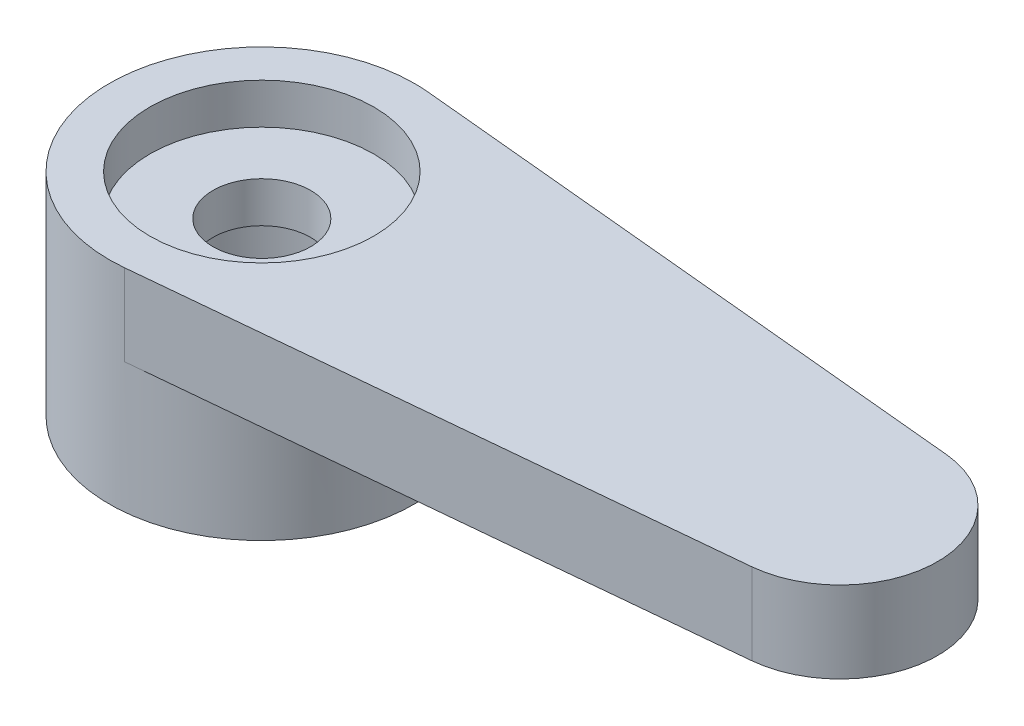
from build123d import *
from build123d.topology import SkipClean

# Parameters (mm, degrees)
SKETCH1_R           = 1.2
BOSS_EXTRUDE1_DEPTH = 2
BOSS_EXTRUDE2_START = 3.2
SKETCH2_R           = 1.2
BOSS_EXTRUDE2_DEPTH = 3.2
SKETCH3_R           = 2.4
CUT_EXTRUDE3_DEPTH  = 3.2
SKETCH4_R           = 2.75
CUT_EXTRUDE4_DEPTH  = 1


with BuildPart() as part:
    # Sketch1 → Boss-Extrude1 (new body)
    with BuildSketch(Plane(origin=(0, 0, 0), x_dir=(1, 0, 0), z_dir=(0, 1, 0))):
        with BuildLine():
            Line((0.356514085, 3.73301456), (14.428169014, 2.389129319))
            ThreePointArc((14.428169014, 2.389129319), (16.6, 0), (14.428169014, -2.389129319))
            Line((14.428169014, -2.389129319), (0.356514085, -3.73301456))
            ThreePointArc((0.356514085, -3.73301456), (-3.75, 0), (0.356514085, 3.73301456))
        make_face()
        with Locations(Location((0, 0, 0), (0, 0, 270))):
            Circle(SKETCH1_R, mode=Mode.SUBTRACT)
    extrude(amount=BOSS_EXTRUDE1_DEPTH)

    # Sketch2 → Boss-Extrude2 (add)
    with SkipClean():  # the faces are left unmerged after this step: merging them gives an invalid solid
        with BuildSketch(Plane.XZ.offset(BOSS_EXTRUDE2_START)):
            with BuildLine():
                ThreePointArc((3.75, 0), (2.774835835, 2.522456361), (0.356514085, 3.73301456))
                ThreePointArc((0.356514085, 3.73301456), (-3.75, 0), (0.356514085, -3.73301456))
                ThreePointArc((0.356514085, -3.73301456), (2.774835835, -2.522456361), (3.75, 0))
            make_face()
            with Locations(Location((0, 0, 0), (0, 0, 270))):
                Circle(SKETCH2_R, mode=Mode.SUBTRACT)
        extrude(amount=-BOSS_EXTRUDE2_DEPTH)

    # Sketch3 → Cut-Extrude3 (cut)
    with BuildSketch(Plane.XZ.offset(3.2)):
        with Locations(Location((0, 0, 0), (0, 0, 270))):
            Circle(SKETCH3_R)
    extrude(amount=-CUT_EXTRUDE3_DEPTH, mode=Mode.SUBTRACT)

    # Sketch4 → Cut-Extrude4 (cut)
    with BuildSketch(Plane(origin=(0, 2, 0), x_dir=(1, 0, 0), z_dir=(0, 1, 0))):
        with Locations(Location((0, 0, 0), (0, 0, 270))):
            Circle(SKETCH4_R)
    extrude(amount=-CUT_EXTRUDE4_DEPTH, mode=Mode.SUBTRACT)


solid = part.part
